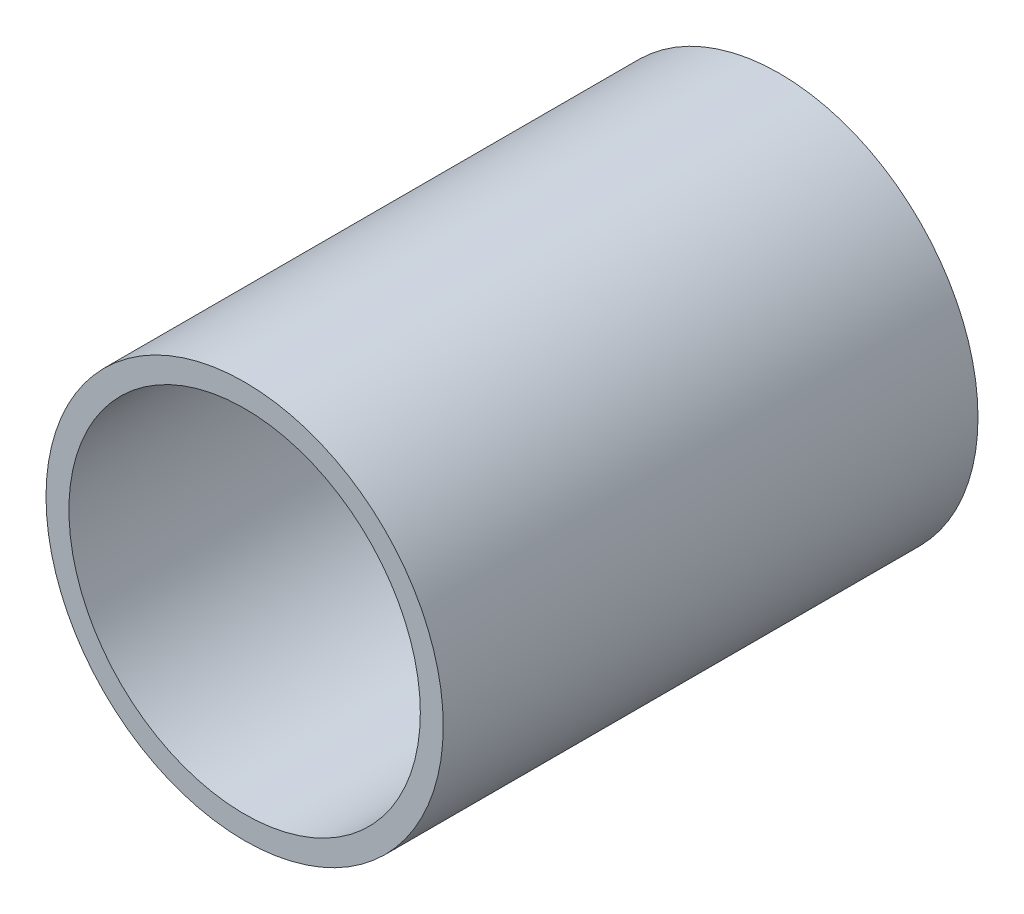
from build123d import *

# Parameters (mm, degrees)
SKETCH1_R           = 26
SKETCH1_R_2         = 23
BOSS_EXTRUDE1_DEPTH = 70


with BuildPart() as part:
    # Sketch1 → Boss-Extrude1 (new body)
    with BuildSketch(Plane.XY):
        Circle(SKETCH1_R)
        Circle(SKETCH1_R_2, mode=Mode.SUBTRACT)
    extrude(amount=BOSS_EXTRUDE1_DEPTH)


solid = part.part
